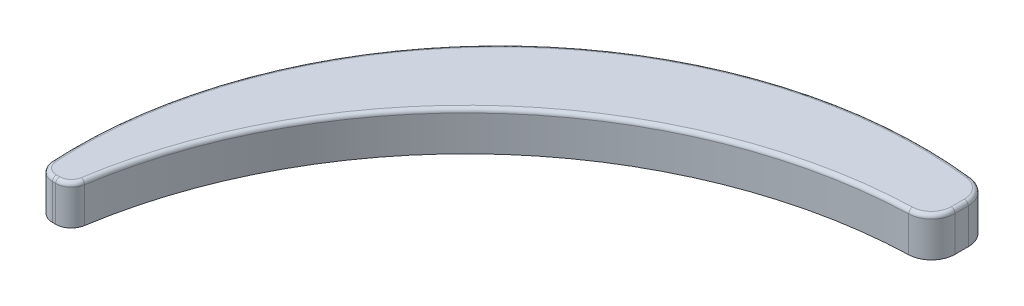
from build123d import *

# Parameters (mm, degrees)
EXTRUDE_1_DEPTH = 5
FILLET_1_R      = 0.5


with BuildPart() as part:
    # Эскиз1 → Бобышка-Вытянуть1 (new body)
    with BuildSketch(Plane(origin=(0, 0, 0), x_dir=(1, 0, 0), z_dir=(0, 1, 0))):
        with BuildLine():
            Line((-25.434053198, 5.944166553), (-25.839949009, 5.944166553))
            ThreePointArc((-25.839949009, 5.944166553), (-27.213842529, 6.49075106), (-27.836787137, 7.831749958))
            ThreePointArc((-27.836787137, 7.831749958), (-10.907888473, 50.216792744), (32.43979713, 64.501666381))
            ThreePointArc((32.43979713, 64.501666381), (34.329532824, 63.515149683), (35.086918855, 61.522492515))
            Line((35.086918855, 61.522492515), (35.086918855, 59.843935519))
            ThreePointArc((35.086918855, 59.843935519), (34.242597527, 57.757539233), (32.184885879, 56.845535535))
            ThreePointArc((32.184885879, 56.845535535), (-4.499436157, 42.261590709), (-23.458092531, 7.635007302))
            ThreePointArc((-23.458092531, 7.635007302), (-24.133729873, 6.424574749), (-25.434053198, 5.944166553))
        make_face()
    extrude(amount=EXTRUDE_1_DEPTH)

    # Скругление1
    fillet_1_edges = [part.edges().sort_by_distance(p)[0] for p in [
        (34.329532824, 5, -63.515149683),
        (-10.907888473, 5, -50.216792744),
        (-27.213842529, 5, -6.49075106),
        (-25.637001104, 5, -5.944166553),
        (-24.133729873, 5, -6.424574749),
        (-4.499436157, 5, -42.261590709),
        (34.242597527, 5, -57.757539233),
        (35.086918855, 5, -60.683214017),
    ]]
    fillet(fillet_1_edges, radius=FILLET_1_R)


solid = part.part
